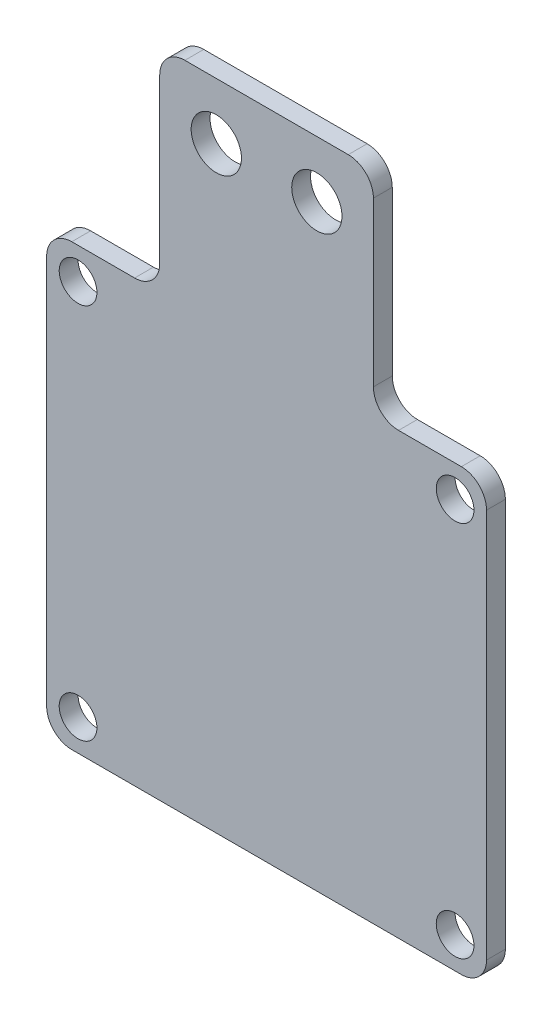
from build123d import *

# Parameters (mm, degrees)
CROQUIS1_R              = 1.5
CROQUIS1_R_2            = 2
SALIENTE_EXTRUIR1_DEPTH = 1.5


with BuildPart() as part:
    # Croquis1 → Saliente-Extruir1 (new body)
    with BuildSketch(Plane.XY):
        with BuildLine():
            Line((0, 0), (-15.5, 0))
            ThreePointArc((-15.5, 0), (-16.914213562, 0.585786438), (-17.5, 2))
            Line((-17.5, 2), (-17.5, 33))
            ThreePointArc((-17.5, 33), (-16.914213562, 34.414213562), (-15.5, 35))
            Line((-15.5, 35), (-10.5, 35))
            ThreePointArc((-10.5, 35), (-9.085786438, 35.585786438), (-8.5, 37))
            Line((-8.5, 37), (-8.5, 50))
            ThreePointArc((-8.5, 50), (-7.914213562, 51.414213562), (-6.5, 52))
            Line((-6.5, 52), (0, 52))
            Line((0, 52), (6.5, 52))
            ThreePointArc((6.5, 52), (7.914213562, 51.414213562), (8.5, 50))
            Line((8.5, 50), (8.5, 37))
            ThreePointArc((8.5, 37), (9.085786438, 35.585786438), (10.5, 35))
            Line((10.5, 35), (15.5, 35))
            ThreePointArc((15.5, 35), (16.914213562, 34.414213562), (17.5, 33))
            Line((17.5, 33), (17.5, 2))
            ThreePointArc((17.5, 2), (16.914213562, 0.585786438), (15.5, 0))
            Line((15.5, 0), (0, 0))
        make_face()
        with Locations((-15, 2.5)):
            Circle(CROQUIS1_R, mode=Mode.SUBTRACT)
        with Locations((-15, 32.5)):
            Circle(CROQUIS1_R, mode=Mode.SUBTRACT)
        with Locations((-4, 47.5)):
            Circle(CROQUIS1_R_2, mode=Mode.SUBTRACT)
        with Locations(Location((4, 47.5, 0), (0, 0, 180))):
            Circle(CROQUIS1_R_2, mode=Mode.SUBTRACT)
        with Locations(Location((15, 32.5, 0), (0, 0, 180))):
            Circle(CROQUIS1_R, mode=Mode.SUBTRACT)
        with Locations(Location((15, 2.5, 0), (0, 0, 180))):
            Circle(CROQUIS1_R, mode=Mode.SUBTRACT)
    extrude(amount=SALIENTE_EXTRUIR1_DEPTH)


solid = part.part
